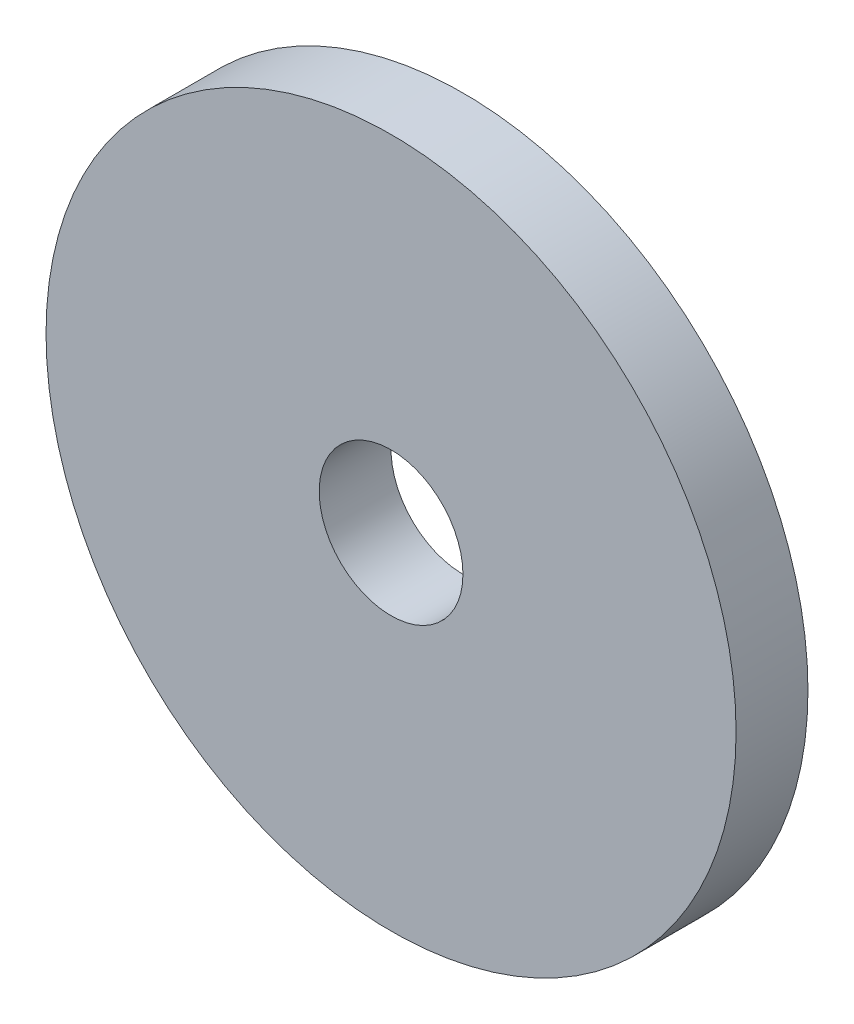
from build123d import *

# Parameters (mm, degrees)
SKETCH_3_R          = 48
EXTRUDE_2_DEPTH     = 10
SKETCH_4_R          = 10
CUT_EXTRUDE_2_DEPTH = 10


with BuildPart() as part:
    # 草图3 → 凸台-拉伸2 (new body)
    with BuildSketch(Plane.XY):
        Circle(SKETCH_3_R)
    extrude(amount=EXTRUDE_2_DEPTH)

    # 草图4 → 切除-拉伸2 (cut)
    with BuildSketch(Plane.XY.offset(10)):
        Circle(SKETCH_4_R)
    extrude(amount=-CUT_EXTRUDE_2_DEPTH, mode=Mode.SUBTRACT)


solid = part.part
